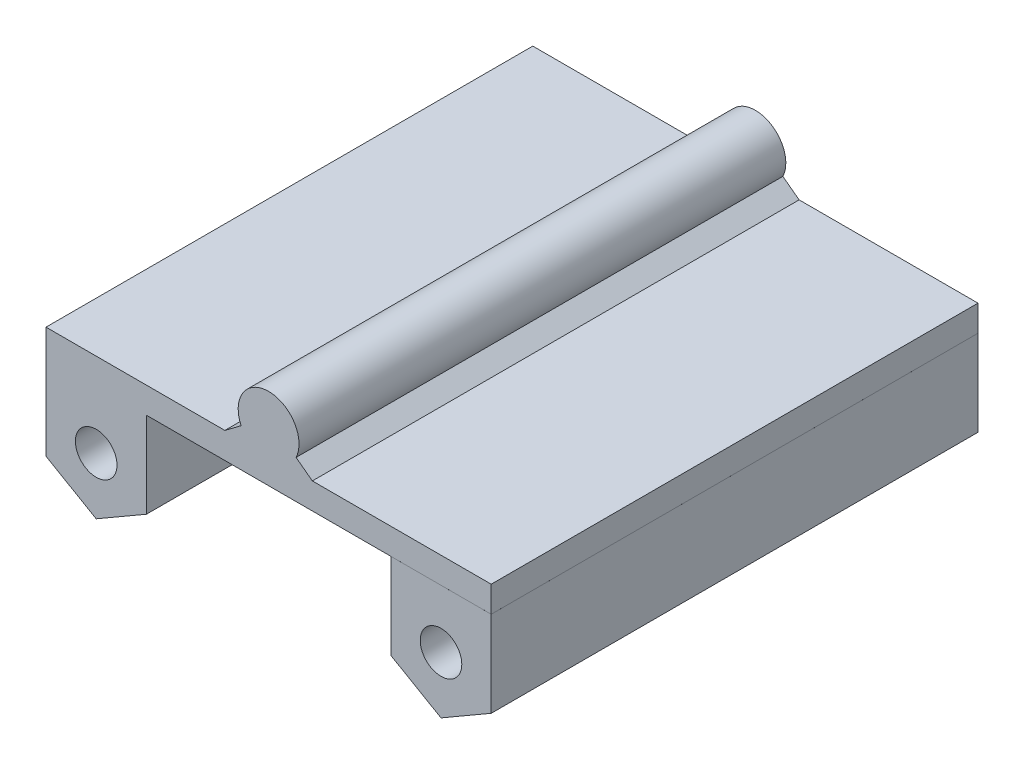
from build123d import *

# Parameters (mm, degrees)
BOSS_EXTRUDE2_DEPTH   = 24
BOSS_EXTRUDE2_2_DEPTH = 24
SKETCH6_R             = 1.025
CUT_EXTRUDE1_DEPTH    = 5
CUT_EXTRUDE2_START    = -5
SKETCH7_R             = 1.025
CUT_EXTRUDE2_DEPTH    = 5
CUT_EXTRUDE4_DEPTH    = 7000


with BuildPart() as part:
    # Sketch3 → Boss-Extrude2 (new body)
    with BuildSketch(Plane.XY):
        with BuildLine():
            Line((0, 1.284473501), (0, -4.23))
            Line((0, -4.23), (2.475, -5.663169564))
            Line((2.475, -5.663169564), (4.95, -4.23))
            Line((4.95, -4.23), (4.95, 0))
            Line((4.95, 0), (10.974918748, 0))
            Line((10.974918748, 0), (17, -0.000257875))
            Line((17, -0.000257875), (17, 0))
            Line((17, 0), (21.949837505, 0))
            Line((21.949837505, 0), (21.949892461, 1.28400377))
            Line((21.949892461, 1.28400377), (13.928131848, 1.284347104))
            Line((13.928131848, 1.284347104), (13.13155756, 1.284381197))
            Line((13.13155756, 1.284381197), (12.329651428, 1.886055123))
            ThreePointArc((12.329651428, 1.886055123), (12.474649771, 2.499007586), (12.355214929, 3.117449627))
            ThreePointArc((12.355214929, 3.117449627), (10.359172253, 3.897908673), (9.620266793, 1.886113105))
            Line((9.620266793, 1.886113105), (8.81833491, 1.284473501))
            Line((8.81833491, 1.284473501), (0, 1.284473501))
        make_face()
    extrude(amount=BOSS_EXTRUDE2_DEPTH)


with BuildPart() as body_2:
    # Sketch3 → Boss-Extrude2 2 (new body)
    with BuildSketch(Plane.XY):
        Polygon((21.949837485, -0.00046973), (17, -0.000257875), (17, -4.23), (19.475, -5.663169564), (21.95, -4.23), (21.95, 0), (21.949837505, 0), align=None)
    extrude(amount=BOSS_EXTRUDE2_2_DEPTH)


with BuildPart() as cut_extrude1_tool:
    # Sketch6 → Cut-Extrude1 (new body)
    with BuildSketch(Plane.XY.offset(24)):
        with Locations((2.475, -2.863169564)):
            Circle(SKETCH6_R)
        with Locations((19.475, -2.863169564)):
            Circle(SKETCH6_R)
    extrude(amount=-CUT_EXTRUDE1_DEPTH)


with BuildPart() as part_1:
    add(part.part)

    # Cut-Extrude1: cut by cut_extrude1_tool
    add(cut_extrude1_tool.part, mode=Mode.SUBTRACT)


with BuildPart() as body_2_1:
    add(body_2.part)

    # Cut-Extrude1: cut by cut_extrude1_tool
    add(cut_extrude1_tool.part, mode=Mode.SUBTRACT)


with BuildPart() as cut_extrude2_tool:
    # Sketch7 → Cut-Extrude2 (new body)
    with BuildSketch(Plane(origin=(0, 0, 0), x_dir=(-1, 0, 0), z_dir=(0, 0, -1)).offset(CUT_EXTRUDE2_START)):
        with Locations(Location((-19.475, -2.863169564, 0), (0, 0, 180))):
            Circle(SKETCH7_R)
        with Locations(Location((-2.475, -2.863169564, 0), (0, 0, 180))):
            Circle(SKETCH7_R)
    extrude(amount=CUT_EXTRUDE2_DEPTH)


with BuildPart() as part_2:
    add(part_1.part)

    # Cut-Extrude2: cut by cut_extrude2_tool
    add(cut_extrude2_tool.part, mode=Mode.SUBTRACT)


with BuildPart() as body_2_2:
    add(body_2_1.part)

    # Cut-Extrude2: cut by cut_extrude2_tool
    add(cut_extrude2_tool.part, mode=Mode.SUBTRACT)


with BuildPart() as cut_extrude4_tool:
    # Sketch8 → Cut-Extrude4 (new body)
    with BuildSketch(Plane(origin=(0, 0, 5), x_dir=(-1, 0, 0), z_dir=(0, 0, -1))):
        Polygon((-18.608974596, -2.863169564), (-19.041987298, -2.113169564), (-19.908012702, -2.113169564), (-20.341025404, -2.863169564), (-19.908012702, -3.613169564), (-19.041987298, -3.613169564), align=None)
        Polygon((-1.45, -2.863169564), (-1.9625, -1.975493525), (-2.9875, -1.975493525), (-3.5, -2.863169564), (-2.9875, -3.750845603), (-1.9625, -3.750845603), align=None)
    extrude(amount=-CUT_EXTRUDE4_DEPTH)


with BuildPart() as part_3:
    add(part_2.part)

    # Cut-Extrude4: cut by cut_extrude4_tool
    add(cut_extrude4_tool.part, mode=Mode.SUBTRACT)


with BuildPart() as body_2_3:
    add(body_2_2.part)

    # Cut-Extrude4: cut by cut_extrude4_tool
    add(cut_extrude4_tool.part, mode=Mode.SUBTRACT)


solid = Compound([part_3.part, body_2_3.part])
